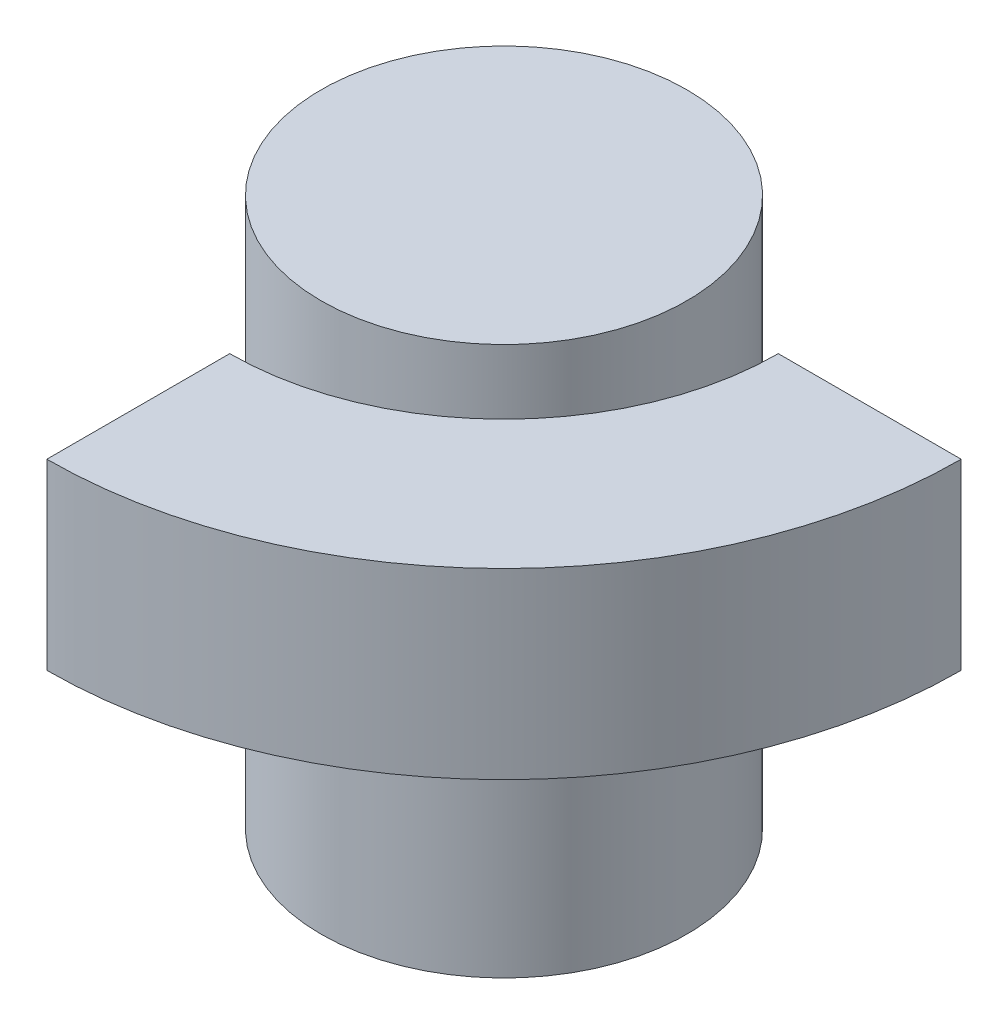
from build123d import *

# Parameters (mm, degrees)
BOSS_EXTRUDE1_DEPTH      = 15
BOSS_EXTRUDE1_DEPTH_BACK = 15
SKETCH1_R                = 10
SKETCH2_W                = 10
SKETCH2_H                = 10
REVOLVE1_ANGLE           = 90


with BuildPart() as part:
    # Sketch1 → Boss-Extrude1 (new, two sides: drawn at the far end of the back side and taken through both)
    with BuildSketch(Plane(origin=(0, 0, 0), x_dir=(1, 0, 0), z_dir=(0, 1, 0)).offset(-BOSS_EXTRUDE1_DEPTH_BACK)):
        with Locations((20, 0)):
            Circle(SKETCH1_R)
    extrude(amount=BOSS_EXTRUDE1_DEPTH + BOSS_EXTRUDE1_DEPTH_BACK)


with BuildPart() as body_2:
    # Sketch2 → Revolve1 (revolve)
    with BuildSketch(Plane.XY):
        with Locations((40, 10)):
            Rectangle(SKETCH2_W, SKETCH2_H)
    revolve(axis=Axis((20, -15, 0), (0, -1, 0)), revolution_arc=REVOLVE1_ANGLE)


solid = Compound([part.part, body_2.part])
